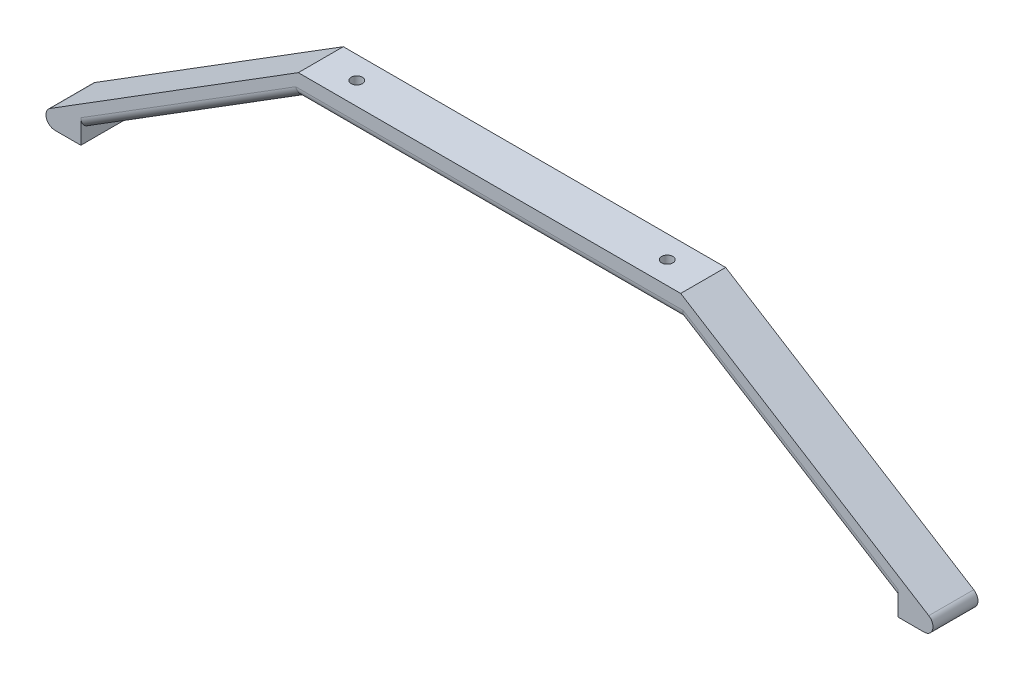
from build123d import *

# Parameters (mm, degrees)
BOSS_EXTRU_2_DEPTH      = 10
ESQUISSE3_R             = 1.25
ENL_V_MAT_EXTRU_1_DEPTH = 10
CONG_1_R                = 2
CONG_2_R                = 2
CONG_3_R                = 2
CONG_4_R                = 2


with BuildPart() as part:
    # Esquisse2 → Boss.-Extru.2 (new body)
    with BuildSketch(Plane.XY):
        Polygon((0, 0), (85, 0), (146.059462923, -38.154187025), (133.338741481, -38.154187025), (133.338741481, -35.205398061), (85, -5), (0, -5), (-48.338741481, -35.205398061), (-48.338741481, -38.154187025), (-61.059462923, -38.154187025), align=None)
    extrude(amount=BOSS_EXTRU_2_DEPTH)

    # Esquisse3 → Enlèv. mat.-Extru.1 (cut)
    with BuildSketch(Plane(origin=(0, 0, 0), x_dir=(1, 0, 0), z_dir=(0, 1, 0))):
        with Locations(Location((77, -5, 0), (0, 0, 270))):
            Circle(ESQUISSE3_R)
        with Locations(Location((8, -5, 0), (0, 0, 270))):
            Circle(ESQUISSE3_R)
    extrude(amount=-ENL_V_MAT_EXTRU_1_DEPTH, mode=Mode.SUBTRACT)

    # Congé1
    cong_1_edges = [part.edges().sort_by_distance(p)[0] for p in [
        (42.5, -5, 10),
    ]]
    fillet(cong_1_edges, radius=CONG_1_R)

    # Congé2
    cong_2_edges = [part.edges().sort_by_distance(p)[0] for p in [
        (107.569036211, -19.102699031, 10),
        (109.16937074, -20.102699031, 0),
        (-22.569036211, -19.102699031, 10),
        (-24.16937074, -20.102699031, 0),
        (42.5, -5, 0),
    ]]
    fillet(cong_2_edges, radius=CONG_2_R)

    # Congé3
    cong_3_edges = [part.edges().sort_by_distance(p)[0] for p in [
        (-61.059462923, -38.154187025, 5),
    ]]
    fillet(cong_3_edges, radius=CONG_3_R)

    # Congé4
    cong_4_edges = [part.edges().sort_by_distance(p)[0] for p in [
        (146.059462923, -38.154187025, 5),
    ]]
    fillet(cong_4_edges, radius=CONG_4_R)


solid = part.part
